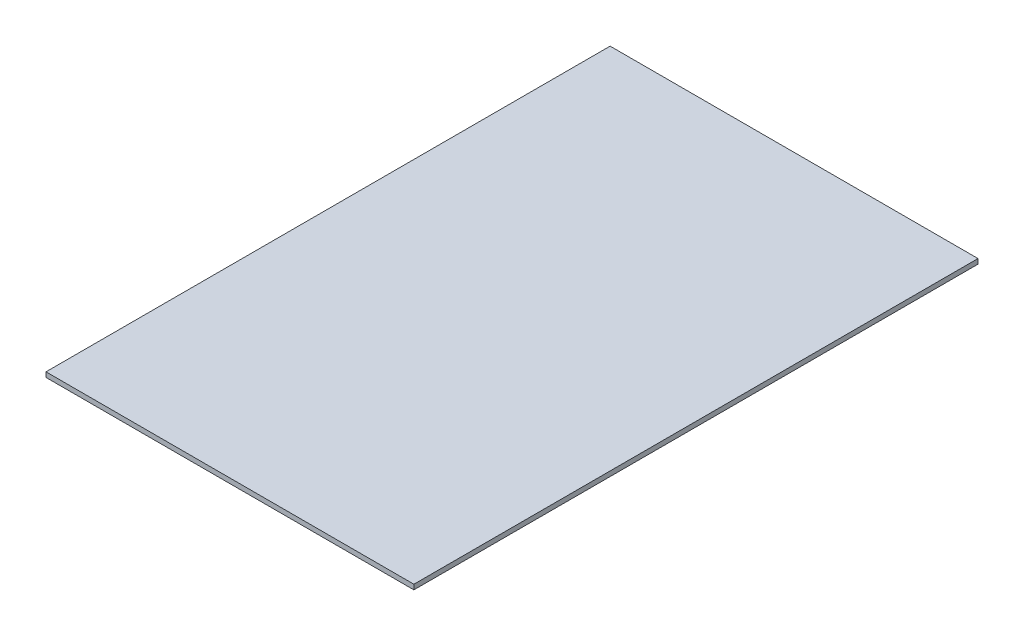
from build123d import *

# Parameters (mm, degrees)
BOSS_EXTRUDE2_START = 395.469836
SKETCH2_W           = 375
SKETCH2_H           = 575
BOSS_EXTRUDE2_DEPTH = 5


with BuildPart() as part:
    # Sketch2 → Boss-Extrude2 (new body)
    with BuildSketch(Plane(origin=(0, 0, 0), x_dir=(1, 0, 0), z_dir=(0, 1, 0)).offset(BOSS_EXTRUDE2_START)):
        with Locations((187.178697975, 142.519627335)):
            Rectangle(SKETCH2_W, SKETCH2_H)
    extrude(amount=BOSS_EXTRUDE2_DEPTH)


solid = part.part
